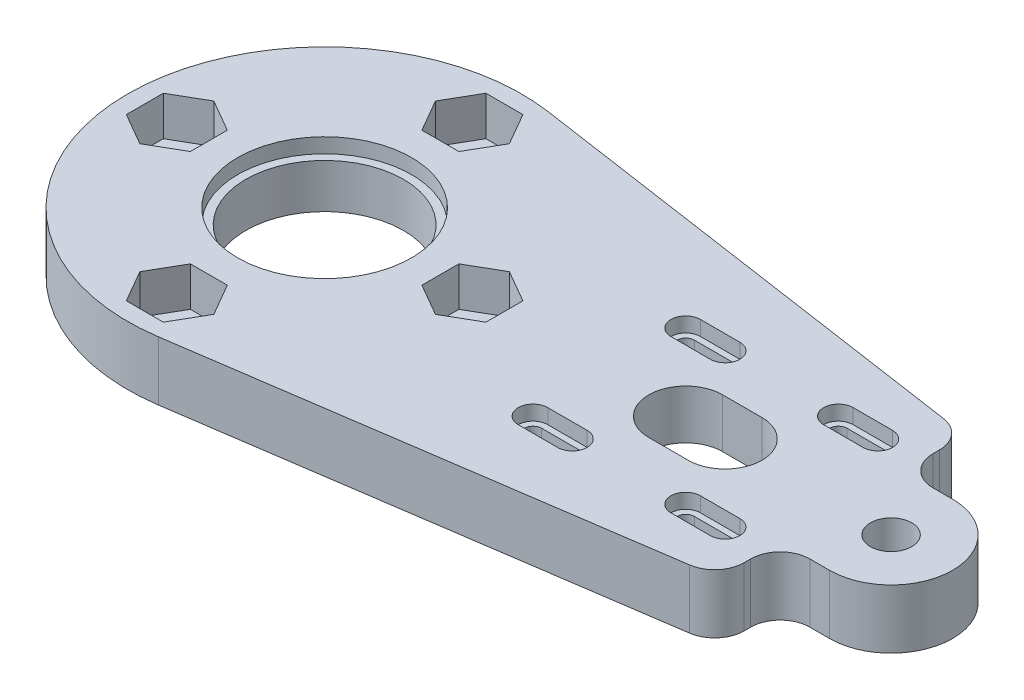
from build123d import *

# Parameters (mm, degrees)
SKETCH1_R           = 10
BOSS_EXTRUDE1_DEPTH = 12
SKETCH2_R           = 17.65
CUT_EXTRUDE1_DEPTH  = 3
CUT_EXTRUDE2_DEPTH  = 12
SKETCH4_R           = 4
CUT_EXTRUDE3_DEPTH  = 12
SKETCH5_R           = 16
CUT_EXTRUDE4_DEPTH  = 113.720894248
SKETCH6_W           = 51
SKETCH6_H           = 43
CUT_EXTRUDE5_DEPTH  = 2
CHAMFER1_SIZE       = 2
CUT_EXTRUDE6_DEPTH  = 8
CUT_EXTRUDE7_DEPTH  = 3
CUT_EXTRUDE8_DEPTH  = 7
SKETCH11_R          = 4.2
BOSS_EXTRUDE2_DEPTH = 12
FILLET1_R           = 6


with BuildPart() as part:
    # Sketch1 → Boss-Extrude1 (new body)
    with BuildSketch(Plane(origin=(0, 0, 0), x_dir=(1, 0, 0), z_dir=(0, 1, 0))):
        with BuildLine():
            Line((5.815477401, 39.574994916), (105, 25))
            Line((105, 25), (105, -25))
            Line((105, -25), (5.815477401, -39.574994916))
            ThreePointArc((5.815477401, -39.574994916), (-40, 0), (5.815477401, 39.574994916))
        make_face()
        with Locations(Location((0, 0, 0), (0, 0, 270))):
            Circle(SKETCH1_R, mode=Mode.SUBTRACT)
    extrude(amount=BOSS_EXTRUDE1_DEPTH)

    # Sketch2 → Cut-Extrude1 (cut)
    with BuildSketch(Plane(origin=(0, 12, 0), x_dir=(1, 0, 0), z_dir=(0, 1, 0))):
        with Locations(Location((0, 0, 0), (0, 0, 270))):
            Circle(SKETCH2_R)
    extrude(amount=-CUT_EXTRUDE1_DEPTH, mode=Mode.SUBTRACT)

    # Sketch3 → Cut-Extrude2 (cut)
    with BuildSketch(Plane(origin=(0, 12, 0), x_dir=(1, 0, 0), z_dir=(0, 1, 0))):
        with BuildLine():
            Line((73.3, 7.5), (81.3, 7.5))
            ThreePointArc((81.3, 7.5), (88.8, 0), (81.3, -7.5))
            Line((81.3, -7.5), (73.3, -7.5))
            ThreePointArc((73.3, -7.5), (65.8, 0), (73.3, 7.5))
        make_face()
    extrude(amount=-CUT_EXTRUDE2_DEPTH, mode=Mode.SUBTRACT)

    # Sketch4 → Cut-Extrude3 (cut)
    with BuildSketch(Plane(origin=(0, 12, 0), x_dir=(1, 0, 0), z_dir=(0, 1, 0))):
        with Locations(Location((30, 0, 0), (0, 0, 270))):
            Circle(SKETCH4_R)
        with Locations(Location((0, -30, 0), (0, 0, 270))):
            Circle(SKETCH4_R)
        with Locations(Location((-30, 0, 0), (0, 0, 270))):
            Circle(SKETCH4_R)
        with Locations(Location((0, 30, 0), (0, 0, 270))):
            Circle(SKETCH4_R)
    extrude(amount=-CUT_EXTRUDE3_DEPTH, mode=Mode.SUBTRACT)

    # Sketch5 → Cut-Extrude4 (cut, through all)
    with BuildSketch(Plane.XZ.offset(-9)):
        with Locations(Location((0, 0, 0), (0, 0, 270))):
            Circle(SKETCH5_R)
    extrude(amount=CUT_EXTRUDE4_DEPTH, mode=Mode.SUBTRACT)

    # Sketch6 → Cut-Extrude5 (cut)
    with BuildSketch(Plane.XZ):
        with Locations((77.3, 0)):
            Rectangle(SKETCH6_W, SKETCH6_H)
    extrude(amount=-CUT_EXTRUDE5_DEPTH, mode=Mode.SUBTRACT)

    # Chamfer1
    chamfer1_edges = [part.edges().sort_by_distance(p)[0] for p in [
        (102.8, 1, 21.5),
        (102.8, 1, -21.5),
        (51.8, 1, -21.5),
        (51.8, 1, 21.5),
    ]]
    chamfer(chamfer1_edges, length=CHAMFER1_SIZE)

    # Sketch7 → Cut-Extrude6 (cut)
    with BuildSketch(Plane(origin=(0, 12, 0), x_dir=(1, 0, 0), z_dir=(0, 1, 0))):
        Polygon((-7.505553499, 30), (-3.75277675, 23.5), (3.75277675, 23.5), (7.505553499, 30), (3.75277675, 36.5), (-3.75277675, 36.5), align=None)
        Polygon((-30, -7.505553499), (-23.5, -3.75277675), (-23.5, 3.75277675), (-30, 7.505553499), (-36.5, 3.75277675), (-36.5, -3.75277675), align=None)
        Polygon((30, 7.505553499), (23.5, 3.75277675), (23.5, -3.75277675), (30, -7.505553499), (36.5, -3.75277675), (36.5, 3.75277675), align=None)
        Polygon((7.505553499, -30), (3.75277675, -23.5), (-3.75277675, -23.5), (-7.505553499, -30), (-3.75277675, -36.5), (3.75277675, -36.5), align=None)
    extrude(amount=-CUT_EXTRUDE6_DEPTH, mode=Mode.SUBTRACT)

    # Sketch9 → Cut-Extrude7 (cut)
    with BuildSketch(Plane(origin=(0, 12, 0), x_dir=(1, 0, 0), z_dir=(0, 1, 0))):
        with BuildLine():
            Line((57.8, 18.5), (65.8, 18.5))
            ThreePointArc((65.8, 18.5), (68.8, 15.5), (65.8, 12.5))
            Line((65.8, 12.5), (57.8, 12.5))
            ThreePointArc((57.8, 12.5), (54.8, 15.5), (57.8, 18.5))
        make_face()
        with BuildLine():
            Line((88.8, 18.5), (96.8, 18.5))
            ThreePointArc((96.8, 18.5), (99.8, 15.5), (96.8, 12.5))
            Line((96.8, 12.5), (88.8, 12.5))
            ThreePointArc((88.8, 12.5), (85.8, 15.5), (88.8, 18.5))
        make_face()
        with BuildLine():
            Line((57.8, -12.5), (65.8, -12.5))
            ThreePointArc((65.8, -12.5), (68.8, -15.5), (65.8, -18.5))
            Line((65.8, -18.5), (57.8, -18.5))
            ThreePointArc((57.8, -18.5), (54.8, -15.5), (57.8, -12.5))
        make_face()
        with BuildLine():
            Line((88.8, -12.5), (96.8, -12.5))
            ThreePointArc((96.8, -12.5), (99.8, -15.5), (96.8, -18.5))
            Line((96.8, -18.5), (88.8, -18.5))
            ThreePointArc((88.8, -18.5), (85.8, -15.5), (88.8, -12.5))
        make_face()
    extrude(amount=-CUT_EXTRUDE7_DEPTH, mode=Mode.SUBTRACT)

    # Sketch10 → Cut-Extrude8 (cut)
    with BuildSketch(Plane(origin=(0, 9, 0), x_dir=(1, 0, 0), z_dir=(0, 1, 0))):
        with BuildLine():
            Line((57.8, 13.75), (65.8, 13.75))
            ThreePointArc((65.8, 13.75), (67.55, 15.5), (65.8, 17.25))
            Line((65.8, 17.25), (57.8, 17.25))
            ThreePointArc((57.8, 17.25), (56.05, 15.5), (57.8, 13.75))
        make_face()
        with BuildLine():
            Line((88.8, 13.75), (96.8, 13.75))
            ThreePointArc((96.8, 13.75), (98.55, 15.5), (96.8, 17.25))
            Line((96.8, 17.25), (88.8, 17.25))
            ThreePointArc((88.8, 17.25), (87.05, 15.5), (88.8, 13.75))
        make_face()
        with BuildLine():
            Line((57.8, -17.25), (65.8, -17.25))
            ThreePointArc((65.8, -17.25), (67.55, -15.5), (65.8, -13.75))
            Line((65.8, -13.75), (57.8, -13.75))
            ThreePointArc((57.8, -13.75), (56.05, -15.5), (57.8, -17.25))
        make_face()
        with BuildLine():
            Line((88.8, -17.25), (96.8, -17.25))
            ThreePointArc((96.8, -17.25), (98.55, -15.5), (96.8, -13.75))
            Line((96.8, -13.75), (88.8, -13.75))
            ThreePointArc((88.8, -13.75), (87.05, -15.5), (88.8, -17.25))
        make_face()
    extrude(amount=-CUT_EXTRUDE8_DEPTH, mode=Mode.SUBTRACT)

    # Sketch11 → Boss-Extrude2 (add)
    with BuildSketch(Plane(origin=(0, 12, 0), x_dir=(1, 0, 0), z_dir=(0, 1, 0))):
        with BuildLine():
            Line((105, -12.5), (105, 12.5))
            Line((105, 12.5), (115, 12.5))
            ThreePointArc((115, 12.5), (127.5, 0), (115, -12.5))
            Line((115, -12.5), (105, -12.5))
        make_face()
        with Locations(Location((115, 0, 0), (0, 0, 270))):
            Circle(SKETCH11_R, mode=Mode.SUBTRACT)
    extrude(amount=-BOSS_EXTRUDE2_DEPTH)

    # Fillet1
    fillet1_edges = [part.edges().sort_by_distance(p)[0] for p in [
        (105, 6, -12.5),
        (105, 6, 12.5),
        (105, 6, -25),
        (105, 6, 25),
    ]]
    fillet(fillet1_edges, radius=FILLET1_R)


solid = part.part
